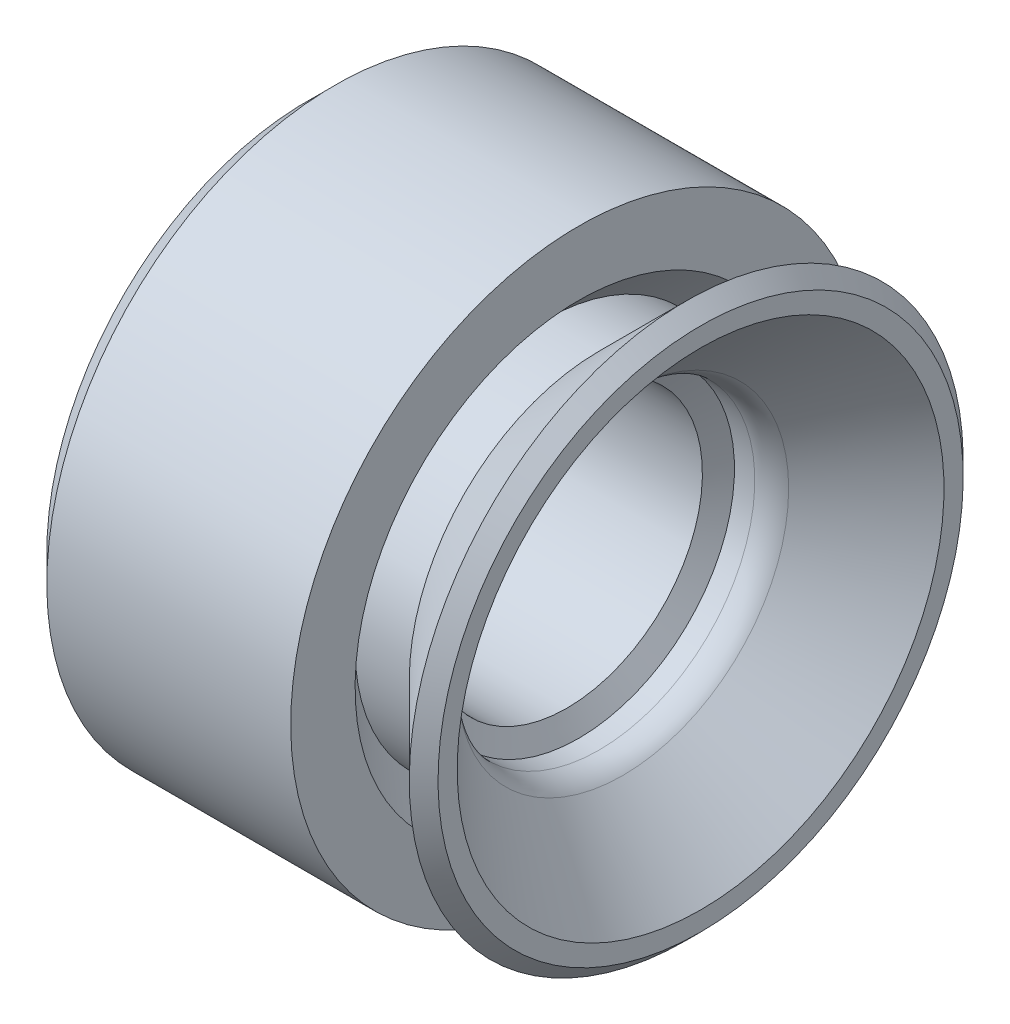
from build123d import *


with BuildPart() as part:
    # Эскиз22 → Revolve 1889 (revolve)
    with BuildSketch(Plane.XY):
        with BuildLine():
            Line((0.5, -2.8), (-0.3, -2.8))
            Line((-0.3, -2.8), (0.2, -3.3))
            Line((0.2, -3.3), (0.2, -4.25))
            Line((0.2, -4.25), (-3.4, -4.25))
            Line((-3.4, -4.25), (-3.8, -3.85))
            Line((-3.8, -3.85), (-3.8, -2.5))
            Line((-3.8, -2.5), (-3.511324865, -2))
            Line((-3.511324865, -2), (0.026794919, -2))
            Line((0.026794919, -2), (0.2, -2.3))
            Line((0.2, -2.3), (0.5, -2.3))
            ThreePointArc((0.5, -2.3), (0.691341716, -2.338060234), (0.853553391, -2.446446609))
            Line((0.853553391, -2.446446609), (2, -3.592893219))
            Line((2, -3.592893219), (2, -3.875735931))
            Line((2, -3.875735931), (1.787867966, -4.087867966))
            Line((1.787867966, -4.087867966), (0.5, -2.8))
        make_face()
    revolve(axis=Axis((0, 0, 0), (1, 0, 0)))


solid = part.part
